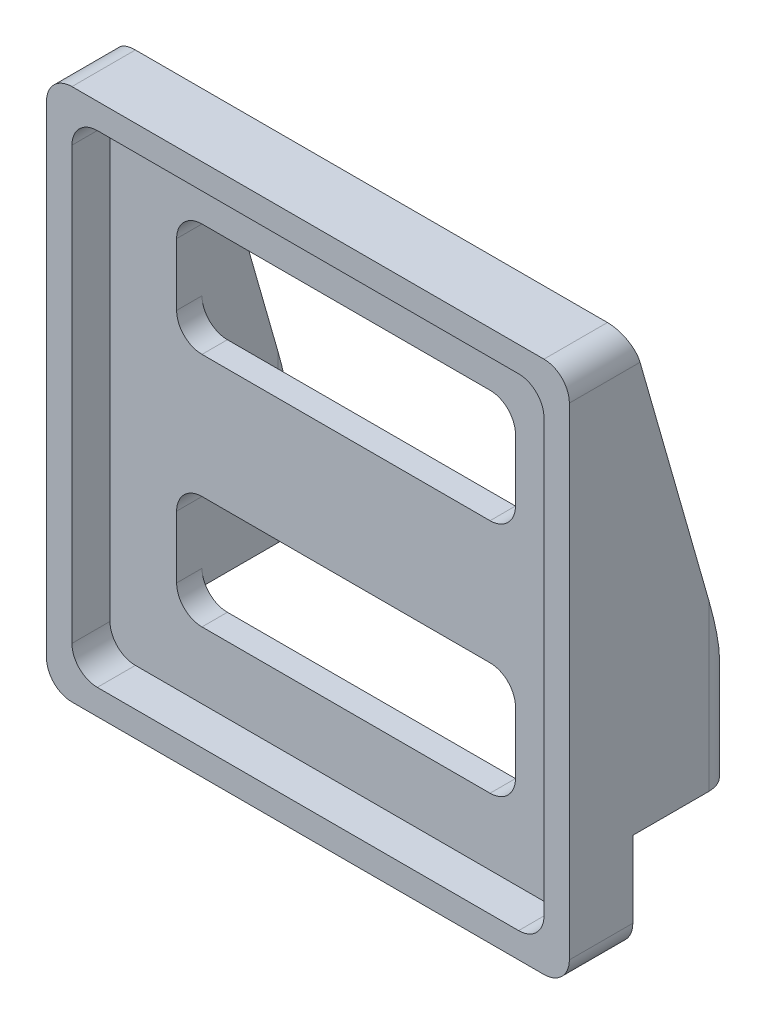
from build123d import *

# Parameters (mm, degrees)
SKETCH1_W           = 41.2
SKETCH1_H           = 42
BOSS_EXTRUDE1_DEPTH = 5
CUT_EXTRUDE1_DEPTH  = 3
CUT_EXTRUDE2_DEPTH  = 2
SKETCH8_W           = 7.25
SKETCH8_H           = 6
BOSS_EXTRUDE4_DEPTH = 8
SKETCH9_W           = 7.25
SKETCH9_H           = 6
BOSS_EXTRUDE5_DEPTH = 8
SKETCH12_R          = 2
CUT_EXTRUDE4_DEPTH  = 6
BOSS_EXTRUDE6_DEPTH = 7.25
FILLET1_R           = 2
FILLET2_R           = 2


with BuildPart() as part:
    # Sketch1 → Boss-Extrude1 (new body)
    with BuildSketch(Plane.XY):
        with Locations((20.6, -21)):
            Rectangle(SKETCH1_W, SKETCH1_H)
    extrude(amount=BOSS_EXTRUDE1_DEPTH)

    # Sketch2 → Cut-Extrude1 (cut)
    with BuildSketch(Plane.XY.offset(5)):
        with BuildLine():
            Line((4, -2), (37.2, -2))
            ThreePointArc((37.2, -2), (38.614213562, -2.585786438), (39.2, -4))
            Line((39.2, -4), (39.2, -38))
            ThreePointArc((39.2, -38), (38.614213562, -39.414213562), (37.2, -40))
            Line((37.2, -40), (4, -40))
            ThreePointArc((4, -40), (2.585786438, -39.414213562), (2, -38))
            Line((2, -38), (2, -4))
            ThreePointArc((2, -4), (2.585786438, -2.585786438), (4, -2))
        make_face()
    extrude(amount=-CUT_EXTRUDE1_DEPTH, mode=Mode.SUBTRACT)

    # Sketch3 → Cut-Extrude2 (cut)
    with BuildSketch(Plane.XY.offset(2)):
        with BuildLine():
            Line((9.25, -7.25), (31.95, -7.25))
            ThreePointArc((31.95, -7.25), (33.364213562, -7.835786438), (33.95, -9.25))
            Line((33.95, -9.25), (33.95, -14.15))
            ThreePointArc((33.95, -14.15), (33.364213562, -15.564213562), (31.95, -16.15))
            Line((31.95, -16.15), (9.25, -16.15))
            ThreePointArc((9.25, -16.15), (7.835786438, -15.564213562), (7.25, -14.15))
            Line((7.25, -14.15), (7.25, -9.25))
            ThreePointArc((7.25, -9.25), (7.835786438, -7.835786438), (9.25, -7.25))
        make_face()
        with BuildLine():
            Line((9.25, -25.85), (31.95, -25.85))
            ThreePointArc((31.95, -25.85), (33.364213562, -26.435786438), (33.95, -27.85))
            Line((33.95, -27.85), (33.95, -32.75))
            ThreePointArc((33.95, -32.75), (33.364213562, -34.164213562), (31.95, -34.75))
            Line((31.95, -34.75), (9.25, -34.75))
            ThreePointArc((9.25, -34.75), (7.835786438, -34.164213562), (7.25, -32.75))
            Line((7.25, -32.75), (7.25, -27.85))
            ThreePointArc((7.25, -27.85), (7.835786438, -26.435786438), (9.25, -25.85))
        make_face()
    extrude(amount=-CUT_EXTRUDE2_DEPTH, mode=Mode.SUBTRACT)

    # Sketch8 → Boss-Extrude4 (add)
    with BuildSketch(Plane(origin=(0, 0, 0), x_dir=(-1, 0, 0), z_dir=(0, 0, -1))):
        with Locations((-37.575, -31)):
            Rectangle(SKETCH8_W, SKETCH8_H)
    extrude(amount=BOSS_EXTRUDE4_DEPTH)

    # Sketch9 → Boss-Extrude5 (add)
    with BuildSketch(Plane(origin=(0, 0, 0), x_dir=(-1, 0, 0), z_dir=(0, 0, -1))):
        with Locations((-3.625, -31)):
            Rectangle(SKETCH9_W, SKETCH9_H)
    extrude(amount=BOSS_EXTRUDE5_DEPTH)

    # Sketch12 → Cut-Extrude4 (cut)
    with BuildSketch(Plane(origin=(0, -28, 0), x_dir=(1, 0, 0), z_dir=(0, 1, 0))):
        with Locations(Location((37.575, 4, 0), (0, 0, 270))):
            Circle(SKETCH12_R)
    cut_extrude4 = extrude(amount=-CUT_EXTRUDE4_DEPTH, mode=Mode.SUBTRACT)

    # Sketch13 → Boss-Extrude6 (add)
    with BuildSketch(Plane(origin=(41.2, 0, 0), x_dir=(0, 0, -1), z_dir=(1, 0, 0))):
        Polygon((8, -28), (0, 0), (0, -28), align=None)
    boss_extrude6 = extrude(amount=-BOSS_EXTRUDE6_DEPTH)

    # Mirror2: Cut-Extrude4, Boss-Extrude6 across plane
    add(cut_extrude4.mirror(Plane(origin=(20.6, 0, 0), x_dir=(0, 0, 1), z_dir=(1, 0, 0))), mode=Mode.SUBTRACT)
    add(boss_extrude6.mirror(Plane(origin=(20.6, 0, 0), x_dir=(0, 0, 1), z_dir=(1, 0, 0))))

    # Fillet1
    fillet1_edges = [part.edges().sort_by_distance(p)[0] for p in [
        (0, 0, 2.5),
        (41.2, 0, 2.5),
        (41.2, -42, 2.5),
        (0, -42, 2.5),
    ]]
    fillet(fillet1_edges, radius=FILLET1_R)

    # Fillet2
    fillet2_edges = [part.edges().sort_by_distance(p)[0] for p in [
        (0, -31, -8),
        (7.25, -31, -8),
        (41.2, -31, -8),
        (33.95, -31, -8),
    ]]
    fillet(fillet2_edges, radius=FILLET2_R)


solid = part.part
